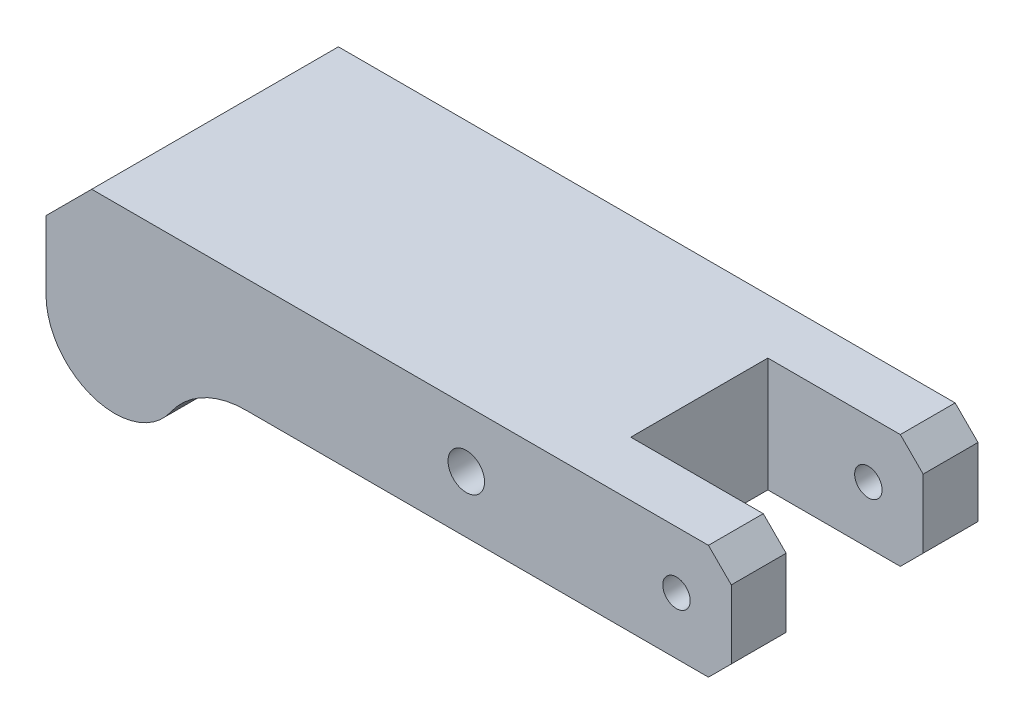
from build123d import *

# Parameters (mm, degrees)
SKETCH1_R           = 3
SKETCH1_R_2         = 4
BOSS_EXTRUDE1_DEPTH = 54
SKETCH2_W           = 34
SKETCH2_H           = 30
CUT_EXTRUDE1_DEPTH  = 101.702532242
CHAMFER1_SIZE       = 10
CHAMFER2_SIZE       = 5


with BuildPart() as part:
    # Sketch1 → Boss-Extrude1 (new body)
    with BuildSketch(Plane.XY):
        with BuildLine():
            Line((-31.277186767, -12.5), (75, -12.5))
            Line((75, -12.5), (75, 12.5))
            Line((75, 12.5), (-75, 12.5))
            Line((-75, 12.5), (-75, -12.5))
            ThreePointArc((-75, -12.5), (-64.491845028, -26.811650088), (-47.6902229, -21.071428571))
            ThreePointArc((-47.6902229, -21.071428571), (-40.535387765, -14.771894791), (-31.277186767, -12.5))
        make_face()
        with Locations((63, 0)):
            Circle(SKETCH1_R, mode=Mode.SUBTRACT)
        with Locations((17, 0)):
            Circle(SKETCH1_R_2, mode=Mode.SUBTRACT)
    extrude(amount=BOSS_EXTRUDE1_DEPTH)

    # Sketch2 → Cut-Extrude1 (cut, through all)
    with BuildSketch(Plane(origin=(0, 12.5, 0), x_dir=(1, 0, 0), z_dir=(0, 1, 0))):
        with Locations((58, -27)):
            Rectangle(SKETCH2_W, SKETCH2_H)
    extrude(amount=-CUT_EXTRUDE1_DEPTH, mode=Mode.SUBTRACT)

    # Chamfer1
    chamfer1_edges = [part.edges().sort_by_distance(p)[0] for p in [
        (-75, 12.5, 27),
    ]]
    chamfer(chamfer1_edges, length=CHAMFER1_SIZE)

    # Chamfer2
    chamfer2_edges = [part.edges().sort_by_distance(p)[0] for p in [
        (75, -12.5, 48),
        (75, 12.5, 48),
        (75, -12.5, 6),
        (75, 12.5, 6),
    ]]
    chamfer(chamfer2_edges, length=CHAMFER2_SIZE)


solid = part.part
